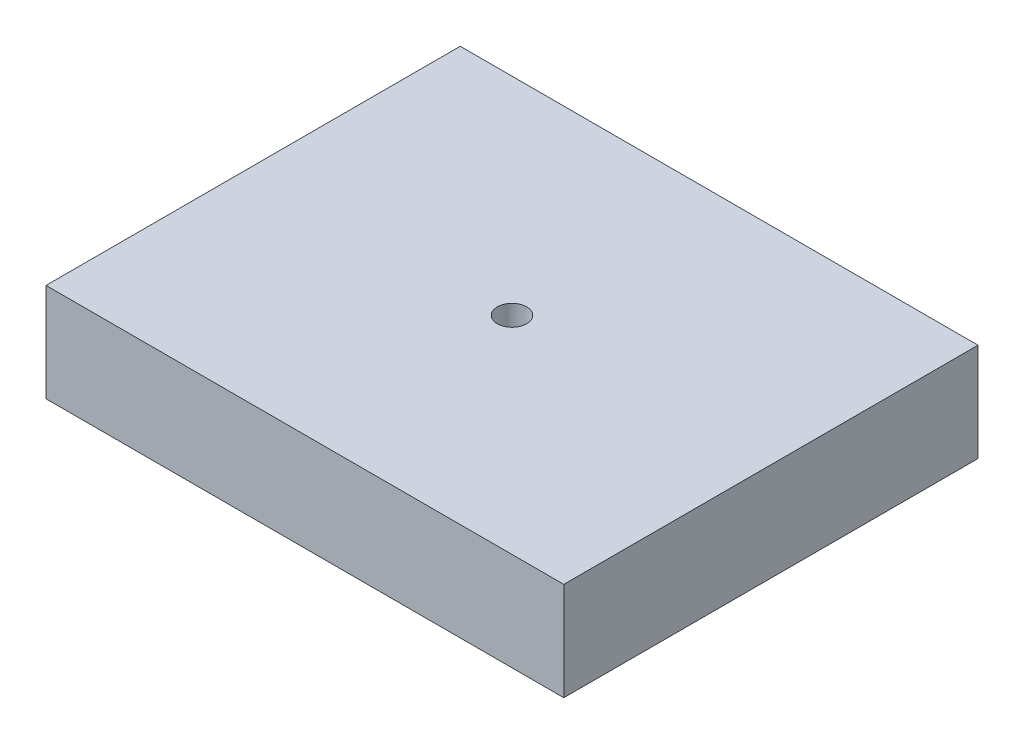
from build123d import *

# Parameters (mm, degrees)
SKETCH1_W             = 66.966244806
SKETCH1_H             = 53.572995846
BOSS_EXTRUDE1_DEPTH   = 12.7
F_6_CLEARANCE_HOLE1_D = 3.7973


with BuildPart() as part:
    # Sketch1 → Boss-Extrude1 (new body)
    with BuildSketch(Plane(origin=(0, 0, 0), x_dir=(1, 0, 0), z_dir=(0, 1, 0))):
        Rectangle(SKETCH1_W, SKETCH1_H)
    extrude(amount=BOSS_EXTRUDE1_DEPTH)

    # #6 Clearance Hole1 (through all)
    with Locations(Plane(origin=(0, 12.7, 0), x_dir=(1, 0, 0), z_dir=(0, 1, 0))):
        with Locations((0, 0)):
            Hole(F_6_CLEARANCE_HOLE1_D / 2)


solid = part.part
